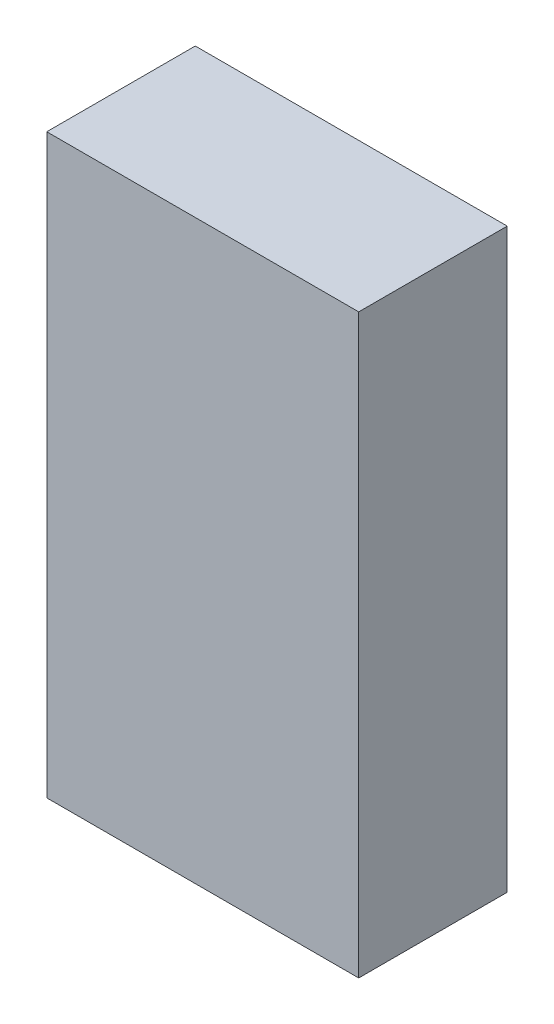
from build123d import *

# Parameters (mm, degrees)
CROQUIS1_W              = 725.131847715
CROQUIS1_H              = 345.221296829
SALIENTE_EXTRUIR1_DEPTH = 1341


with BuildPart() as part:
    # Croquis1 → Saliente-Extruir1 (new body)
    with BuildSketch(Plane(origin=(0, 0, 0), x_dir=(1, 0, 0), z_dir=(0, 1, 0))):
        with Locations((-328.706602557, 135.911532927)):
            Rectangle(CROQUIS1_W, CROQUIS1_H)
    extrude(amount=SALIENTE_EXTRUIR1_DEPTH)


solid = part.part
